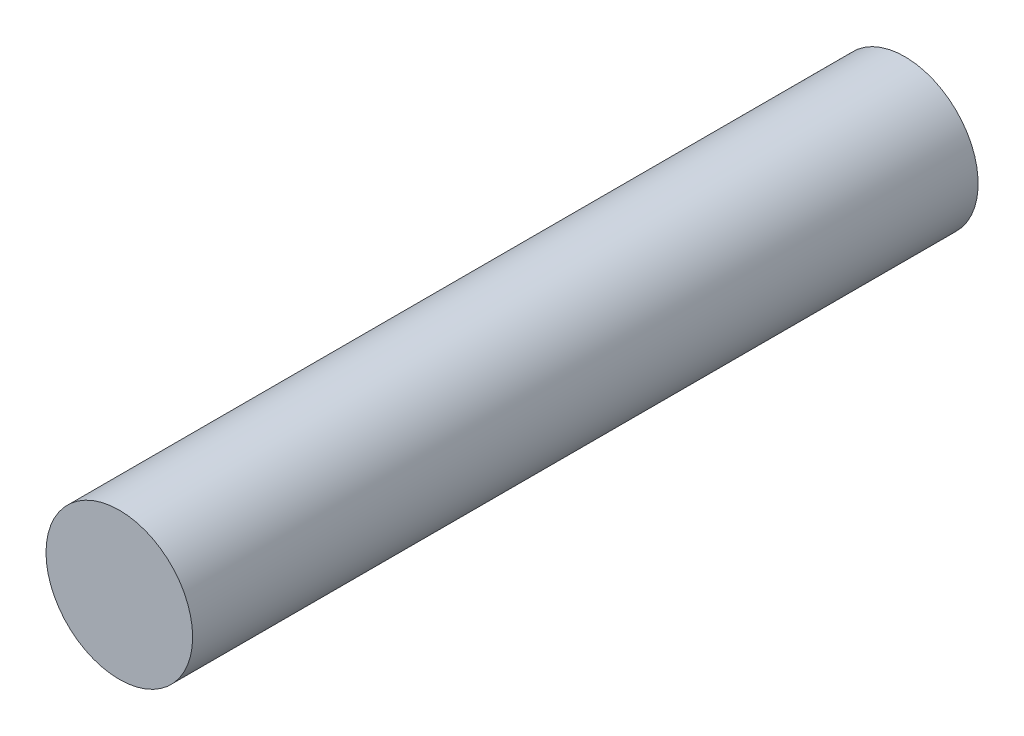
from build123d import *

# Parameters (mm, degrees)
SKETCH1_R           = 7
BOSS_EXTRUDE1_DEPTH = 50
BOSS_EXTRUDE2_START = 25
SKETCH5_R           = 7
BOSS_EXTRUDE2_DEPTH = 25


with BuildPart() as part:
    # Sketch1 → Boss-Extrude1 (new body)
    with BuildSketch(Plane.XY):
        Circle(SKETCH1_R)
    extrude(amount=BOSS_EXTRUDE1_DEPTH)

    # Sketch5 → Boss-Extrude2 (add)
    with BuildSketch(Plane(origin=(0, 0, 0), x_dir=(-1, 0, 0), z_dir=(0, 0, -1)).offset(BOSS_EXTRUDE2_START)):
        Circle(SKETCH5_R)
    extrude(amount=-BOSS_EXTRUDE2_DEPTH)


solid = part.part
